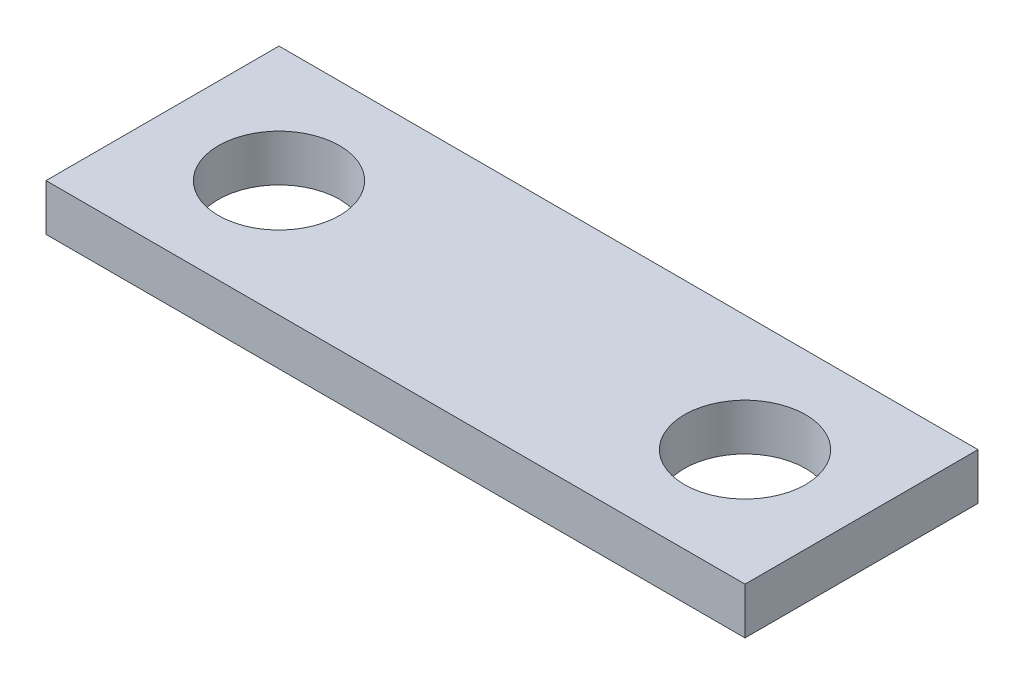
from build123d import *

# Parameters (mm, degrees)
SKETCH_1_W          = 30
SKETCH_1_H          = 10
EXTRUDE_1_DEPTH     = 2
SKETCH_2_R          = 2.6
CUT_EXTRUDE_1_DEPTH = 10


with BuildPart() as part:
    # 草图1 → 凸台-拉伸1 (new body)
    # profile 1 of 2: a face of its own
    with BuildSketch(Plane(origin=(0, 0, 0), x_dir=(1, 0, 0), z_dir=(0, 1, 0))):
        Rectangle(SKETCH_1_W, SKETCH_1_H)
        with BuildLine():
            Line((10, -2.5), (-10, -2.5))
            ThreePointArc((-10, -2.5), (-12.5, 0), (-10, 2.5))
            Line((-10, 2.5), (10, 2.5))
            ThreePointArc((10, 2.5), (11.767766953, 1.767766953), (12.5, 0))
            ThreePointArc((12.5, 0), (11.767766953, -1.767766953), (10, -2.5))
        make_face(mode=Mode.SUBTRACT)
    # profile 2 of 2: a face of its own
    with BuildSketch(Plane(origin=(0, 0, 0), x_dir=(1, 0, 0), z_dir=(0, 1, 0))):
        with BuildLine():
            ThreePointArc((-7.5, 0), (-8.232233047, -1.767766953), (-10, -2.5))
            Line((-10, -2.5), (10, -2.5))
            ThreePointArc((10, -2.5), (7.5, 0), (10, 2.5))
            Line((10, 2.5), (-10, 2.5))
            ThreePointArc((-10, 2.5), (-8.232233047, 1.767766953), (-7.5, 0))
        make_face()
    extrude(amount=EXTRUDE_1_DEPTH)

    # 草图2 → 切除-拉伸1 (cut)
    with BuildSketch(Plane.XZ):
        with Locations(Location((-10, 0, 0), (0, 0, 270))):
            Circle(SKETCH_2_R)
        with Locations(Location((10, 0, 0), (0, 0, 270))):
            Circle(SKETCH_2_R)
    extrude(amount=-CUT_EXTRUDE_1_DEPTH, mode=Mode.SUBTRACT)


solid = part.part
